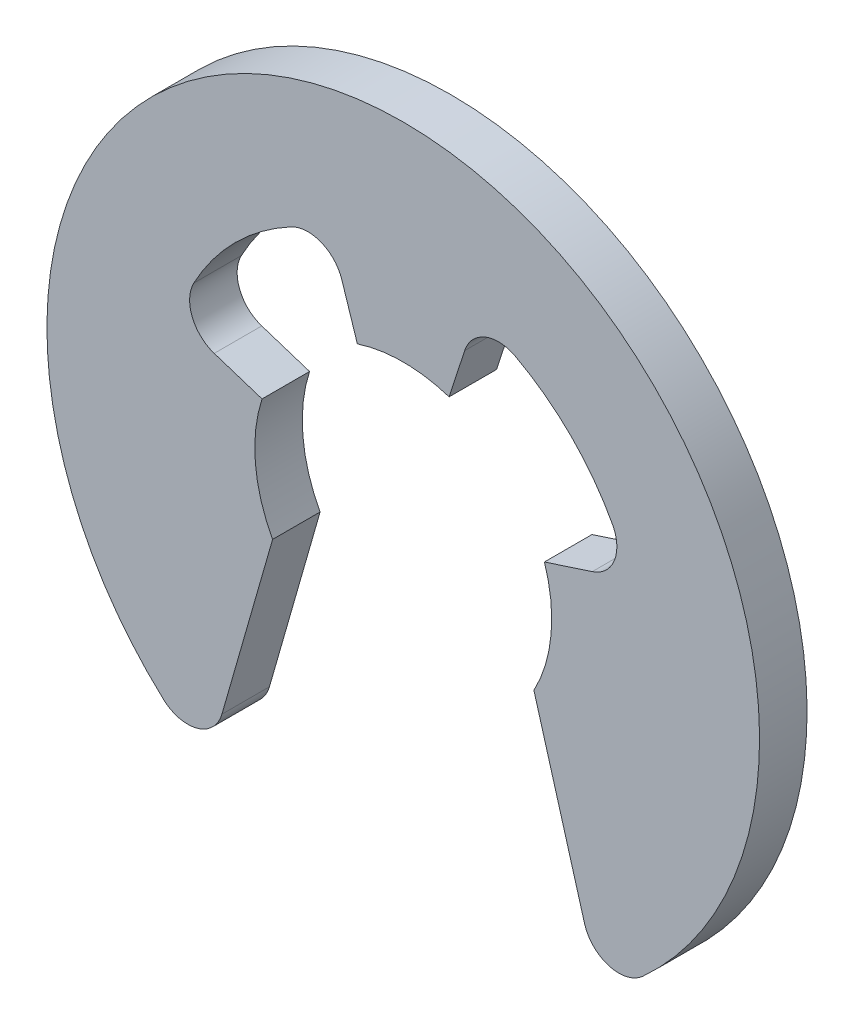
from build123d import *

# Parameters (mm, degrees)
BODY_DEPTH = 0.4


with BuildPart() as part:
    # Sketch1 → Body (new body)
    with BuildSketch(Plane.XY):
        with BuildLine():
            Line((0.517084333, 1.59142194), (0.386271243, 1.188820645))
            ThreePointArc((0.386271243, 1.188820645), (0, 1.25), (-0.386271243, 1.188820645))
            Line((-0.386271243, 1.188820645), (-0.517084333, 1.59142194))
            ThreePointArc((-0.517084333, 1.59142194), (-0.690418116, 1.777032794), (-0.944001516, 1.763196285))
            ThreePointArc((-0.944001516, 1.763196285), (-1.414213562, 1.414213562), (-1.763196285, 0.944001516))
            ThreePointArc((-1.763196285, 0.944001516), (-1.777032794, 0.690418116), (-1.59142194, 0.517084333))
            Line((-1.59142194, 0.517084333), (-1.188820645, 0.386271243))
            ThreePointArc((-1.188820645, 0.386271243), (-1.244897296, -0.112830506), (-1.1, -0.593717104))
            Line((-1.1, -0.593717104), (-1.526646887, -2.081611619))
            ThreePointArc((-1.526646887, -2.081611619), (-1.732937183, -2.287471145), (-2.016694884, -2.22102268))
            ThreePointArc((-2.016694884, -2.22102268), (0, 3), (2.016694884, -2.22102268))
            ThreePointArc((2.016694884, -2.22102268), (1.732937183, -2.287471145), (1.526646887, -2.081611619))
            Line((1.526646887, -2.081611619), (1.1, -0.593717104))
            ThreePointArc((1.1, -0.593717104), (1.244897296, -0.112830506), (1.188820645, 0.386271243))
            Line((1.188820645, 0.386271243), (1.59142194, 0.517084333))
            ThreePointArc((1.59142194, 0.517084333), (1.777032794, 0.690418116), (1.763196285, 0.944001516))
            ThreePointArc((1.763196285, 0.944001516), (1.414213562, 1.414213562), (0.944001516, 1.763196285))
            ThreePointArc((0.944001516, 1.763196285), (0.690418116, 1.777032794), (0.517084333, 1.59142194))
        make_face()
    extrude(amount=-BODY_DEPTH)


solid = part.part
